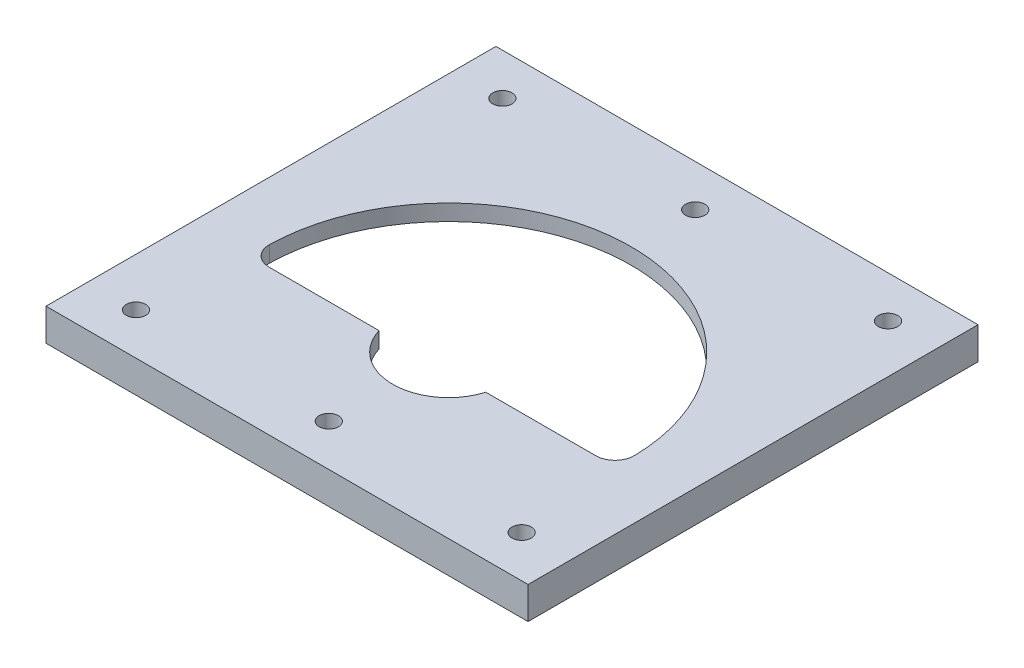
from build123d import *

# Parameters (mm, degrees)
SKETCH1_W           = 75
SKETCH1_H           = 70
BOSS_EXTRUDE1_DEPTH = 5
SKETCH2_R           = 1.5
CUT_EXTRUDE1_DEPTH  = 59.699989832
CUT_EXTRUDE3_DEPTH  = 2.5


with BuildPart() as part:
    # Sketch1 → Boss-Extrude1 (new body)
    with BuildSketch(Plane(origin=(0, 0, 0), x_dir=(1, 0, 0), z_dir=(0, 1, 0))):
        with Locations((0, 9.8825)):
            Rectangle(SKETCH1_W, SKETCH1_H)
        with BuildLine():
            Line((-25.410018342, -2.5), (-8.306962441, -2.5))
            ThreePointArc((-8.306962441, -2.5), (0, -8.675), (8.306962441, -2.5))
            Line((8.306962441, -2.5), (25.410018342, -2.5))
            ThreePointArc((25.410018342, -2.5), (27.552103918, -1.600349825), (28.409437718, 0.559020409))
            ThreePointArc((28.409437718, 0.559020409), (0, 28.414937186), (-28.409437718, 0.559020409))
            ThreePointArc((-28.409437718, 0.559020409), (-27.552103918, -1.600349825), (-25.410018342, -2.5))
        make_face(mode=Mode.SUBTRACT)
    extrude(amount=BOSS_EXTRUDE1_DEPTH)

    # Sketch2 → Cut-Extrude1 (cut, through all)
    with BuildSketch(Plane(origin=(0, 5, 0), x_dir=(1, 0, 0), z_dir=(0, 1, 0))):
        with Locations(Location((-30, 38.3825, 0), (0, 0, 270))):
            Circle(SKETCH2_R)
        with Locations(Location((-30, -18.6175, 0), (0, 0, 270))):
            Circle(SKETCH2_R)
        with Locations(Location((0, -18.6175, 0), (0, 0, 270))):
            Circle(SKETCH2_R)
        with Locations(Location((30, -18.6175, 0), (0, 0, 270))):
            Circle(SKETCH2_R)
        with Locations(Location((30, 38.3825, 0), (0, 0, 270))):
            Circle(SKETCH2_R)
        with Locations(Location((0, 38.3825, 0), (0, 0, 270))):
            Circle(SKETCH2_R)
    extrude(amount=-CUT_EXTRUDE1_DEPTH, mode=Mode.SUBTRACT)

    # Sketch3 → Cut-Extrude3 (cut)
    with BuildSketch(Plane.XZ):
        with BuildLine():
            Line((25.410018342, 7.5), (11.434842587, 7.5))
            ThreePointArc((11.434842587, 7.5), (0, 13.675), (-11.434842587, 7.5))
            Line((-11.434842587, 7.5), (-25.410018342, 7.5))
            ThreePointArc((-25.410018342, 7.5), (-31.122246544, 5.100932866), (-33.408470011, -0.657387759))
            ThreePointArc((-33.408470011, -0.657387759), (0, -33.414937186), (33.408470011, -0.657387759))
            ThreePointArc((33.408470011, -0.657387759), (31.122246544, 5.100932866), (25.410018342, 7.5))
        make_face()
    extrude(amount=-CUT_EXTRUDE3_DEPTH, mode=Mode.SUBTRACT)


solid = part.part
